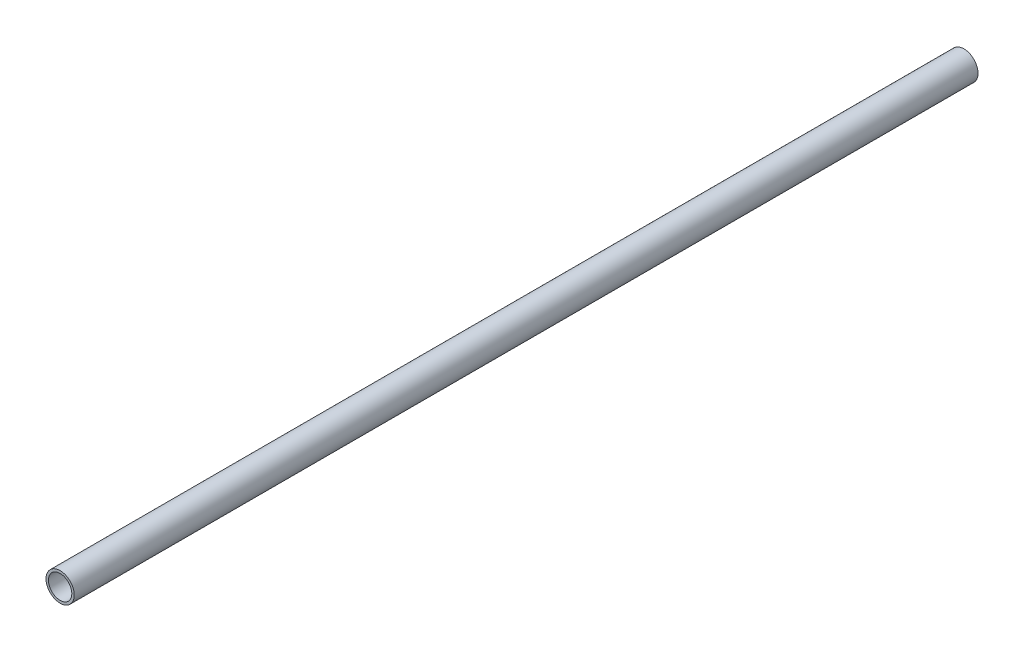
from build123d import *

# Parameters (mm, degrees)
SKETCH3_R           = 9.525
SKETCH3_R_2         = 7.874
BOSS_EXTRUDE1_DEPTH = 304.8


with BuildPart() as part:
    # Sketch3 → Boss-Extrude1 (new, symmetric)
    with BuildSketch(Plane.XY):
        with Locations(Location((0, 0, 0), (0, 0, 180))):
            Circle(SKETCH3_R)
        with Locations(Location((0, 0, 0), (0, 0, 180))):
            Circle(SKETCH3_R_2, mode=Mode.SUBTRACT)
    extrude(amount=BOSS_EXTRUDE1_DEPTH, both=True)


solid = part.part
